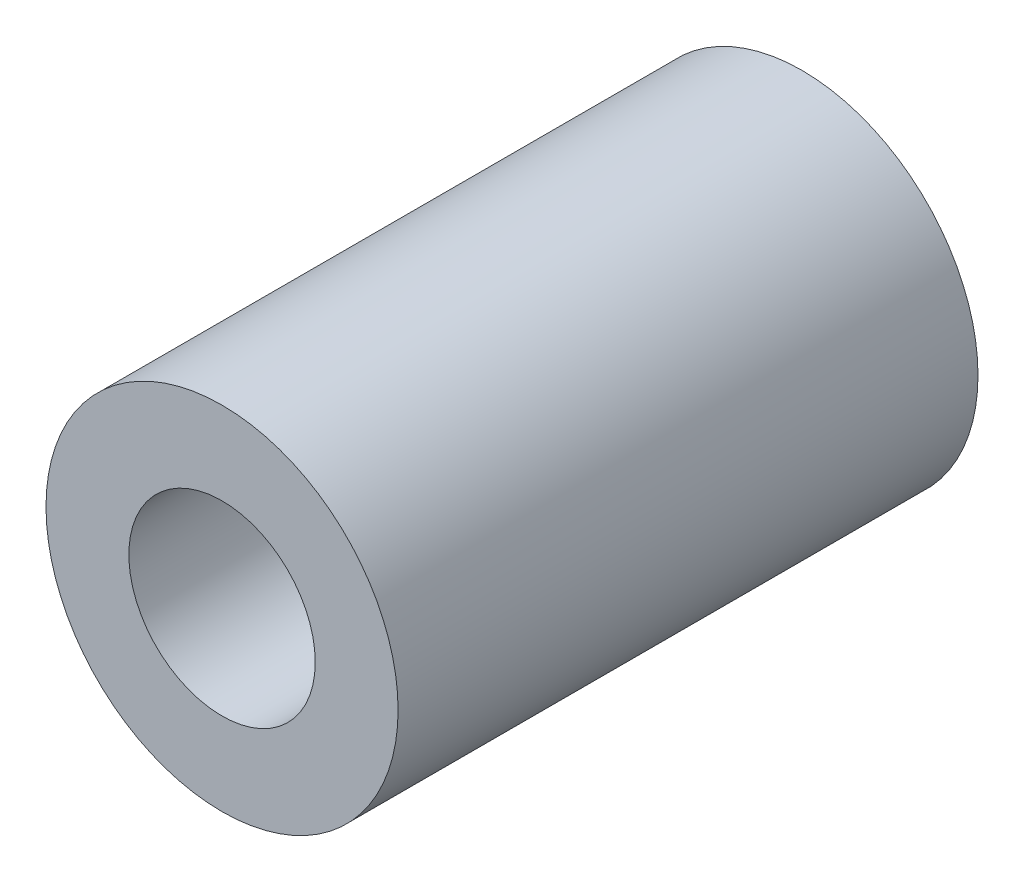
from build123d import *

# Parameters (mm, degrees)
ESQUISSE1_R        = 8.5
ESQUISSE1_R_2      = 4.5
BOSS_EXTRU_1_DEPTH = 28


with BuildPart() as part:
    # Esquisse1 → Boss.-Extru.1 (new body)
    with BuildSketch(Plane.XY):
        Circle(ESQUISSE1_R)
        Circle(ESQUISSE1_R_2, mode=Mode.SUBTRACT)
    extrude(amount=BOSS_EXTRU_1_DEPTH)


solid = part.part
